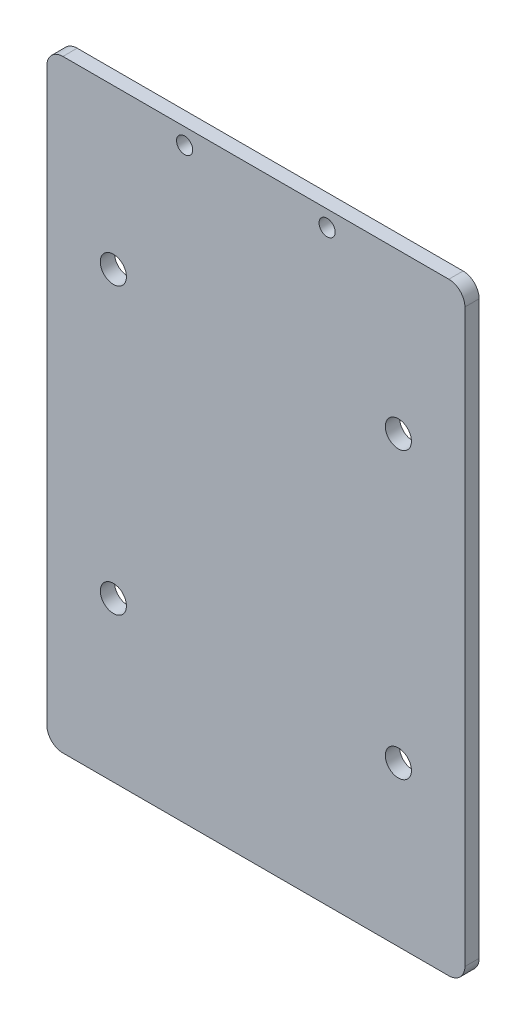
from build123d import *

# Parameters (mm, degrees)
SKETCH1_R           = 2.75
SKETCH1_R_2         = 1.7
BOSS_EXTRUDE1_DEPTH = 3


with BuildPart() as part:
    # Sketch1 → Boss-Extrude1 (new body)
    with BuildSketch(Plane.XY):
        with BuildLine():
            Line((44, -60.12), (44, 60.12))
            ThreePointArc((44, 60.12), (43.01002092, 62.51002092), (40.62, 63.5))
            Line((40.62, 63.5), (-40.62, 63.5))
            ThreePointArc((-40.62, 63.5), (-43.01002092, 62.51002092), (-44, 60.12))
            Line((-44, 60.12), (-44, -60.12))
            ThreePointArc((-44, -60.12), (-43.01002092, -62.51002092), (-40.62, -63.5))
            Line((-40.62, -63.5), (40.62, -63.5))
            ThreePointArc((40.62, -63.5), (43.01002092, -62.51002092), (44, -60.12))
        make_face()
        with Locations((-30, 30)):
            Circle(SKETCH1_R, mode=Mode.SUBTRACT)
        with Locations((30, 30)):
            Circle(SKETCH1_R, mode=Mode.SUBTRACT)
        with Locations((-30, -30)):
            Circle(SKETCH1_R, mode=Mode.SUBTRACT)
        with Locations((30, -30)):
            Circle(SKETCH1_R, mode=Mode.SUBTRACT)
        with Locations((15, 60.11)):
            Circle(SKETCH1_R_2, mode=Mode.SUBTRACT)
        with Locations((-15, 60.11)):
            Circle(SKETCH1_R_2, mode=Mode.SUBTRACT)
    extrude(amount=BOSS_EXTRUDE1_DEPTH)


solid = part.part
